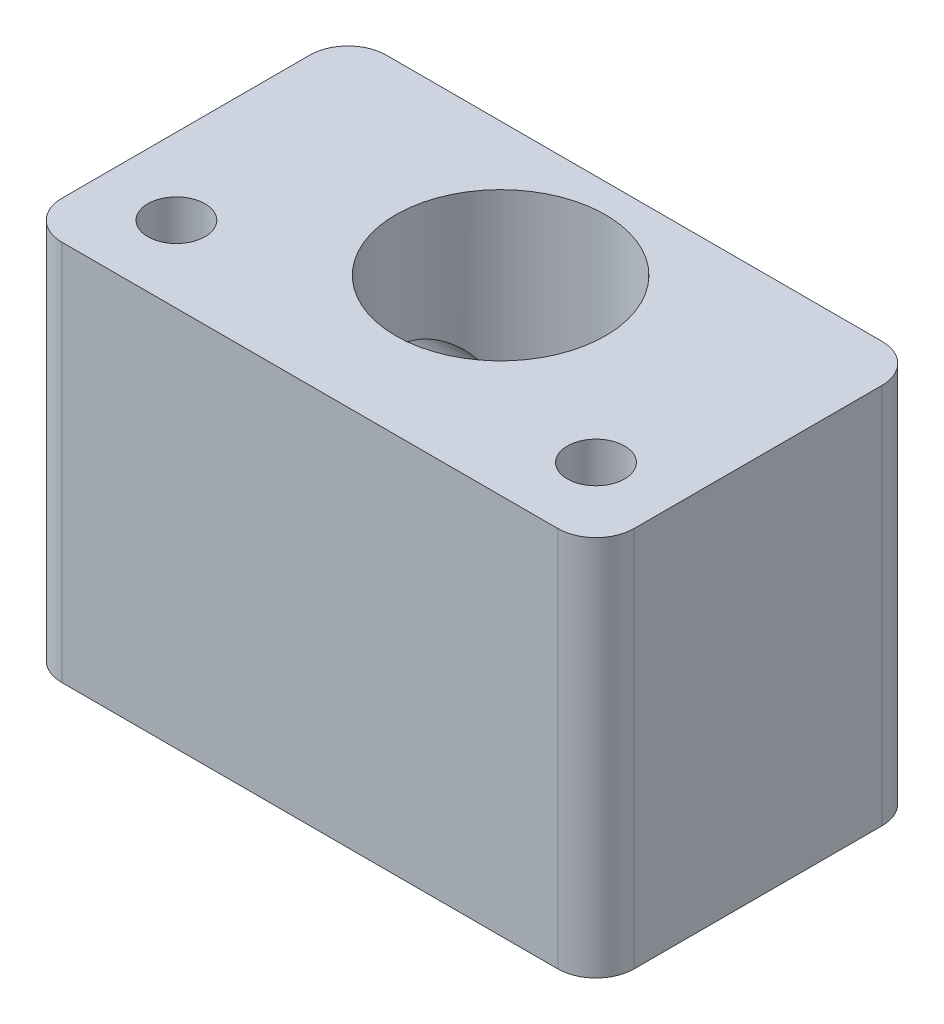
from build123d import *

# Parameters (mm, degrees)
SKETCH_1_W               = 30
SKETCH_1_H               = 17
SKETCH_1_R               = 1.5
SKETCH_1_R_2             = 5.5
EXTRUDE_1_DEPTH          = 20
CUT_EXTRUDE_1_REACH      = 39.044
CUT_EXTRUDE_1_END_RADIUS = 5.5
SKETCH_2_R               = 4
FILLET_1_R               = 2


with BuildPart() as part:
    # 草图1 → 凸台-拉伸1 (new body)
    with BuildSketch(Plane(origin=(0, 0, 0), x_dir=(1, 0, 0), z_dir=(0, 1, 0))):
        Rectangle(SKETCH_1_W, SKETCH_1_H)
        with Locations(Location((-11, -4.5, 0), (0, 0, 270))):
            Circle(SKETCH_1_R, mode=Mode.SUBTRACT)
        with Locations(Location((11, -4.5, 0), (0, 0, 90))):
            Circle(SKETCH_1_R, mode=Mode.SUBTRACT)
        with Locations(Location((0, 1.5, 0), (0, 0, 270))):
            Circle(SKETCH_1_R_2, mode=Mode.SUBTRACT)
    extrude(amount=EXTRUDE_1_DEPTH)

    # 切除-拉伸1: up to this cylinder (the profile starts outside it)
    cut_extrude_1_end = Plane(origin=(0, 10, -1.5), z_dir=(0, -1, 0)) * Cylinder(CUT_EXTRUDE_1_END_RADIUS, 90.088, mode=Mode.PRIVATE)
    # 草图2 → 切除-拉伸1 (cut, up to the surface)
    with BuildSketch(Plane.ZY.offset(15), mode=Mode.PRIVATE) as cut_extrude_1_sk1:
        with Locations((-1.5, 10)):
            Circle(SKETCH_2_R)
    cut_extrude_1_tool1 = extrude(cut_extrude_1_sk1.sketch, amount=-CUT_EXTRUDE_1_REACH, mode=Mode.PRIVATE) - cut_extrude_1_end
    add(cut_extrude_1_tool1.solids().sort_by_distance((-15, 10, -1.5))[0], mode=Mode.SUBTRACT)

    # 圆角1
    fillet_1_edges = [part.edges().sort_by_distance(p)[0] for p in [
        (15, 10, 8.5),
        (-15, 10, 8.5),
        (-15, 10, -8.5),
        (15, 10, -8.5),
    ]]
    fillet(fillet_1_edges, radius=FILLET_1_R)


solid = part.part
